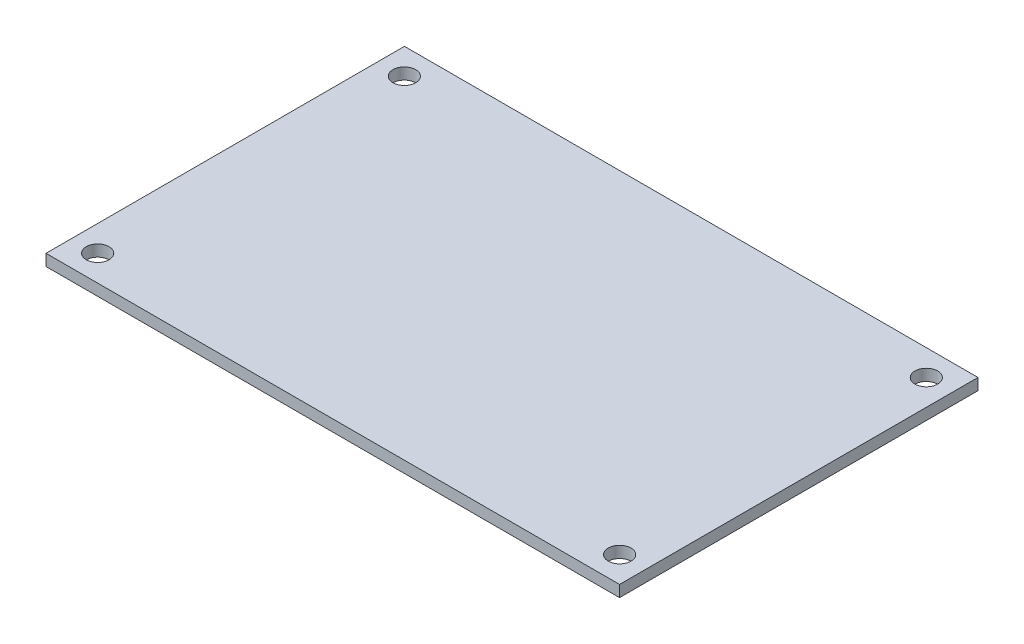
from build123d import *

# Parameters (mm, degrees)
SKETCH1_W           = 80
SKETCH1_H           = 50
BOSS_EXTRUDE1_DEPTH = 0.8001
SKETCH2_R           = 1.5875
CUT_EXTRUDE1_DEPTH  = 48.197040586


with BuildPart() as part:
    # Sketch1 → Boss-Extrude1 (new, symmetric)
    with BuildSketch(Plane(origin=(0, 0, 0), x_dir=(1, 0, 0), z_dir=(0, 1, 0))):
        Rectangle(SKETCH1_W, SKETCH1_H)
    extrude(amount=BOSS_EXTRUDE1_DEPTH, both=True)

    # Sketch2 → Cut-Extrude1 (cut, through all)
    with BuildSketch(Plane(origin=(0, 0.8001, 0), x_dir=(1, 0, 0), z_dir=(0, 1, 0))):
        with Locations(Location((-36.40283621, 21.38740377, 0), (0, 0, 270))):
            Circle(SKETCH2_R)
        with Locations(Location((-36.40283621, -21.38740377, 0), (0, 0, 270))):
            Circle(SKETCH2_R)
        with Locations(Location((36.40283621, -21.38740377, 0), (0, 0, 270))):
            Circle(SKETCH2_R)
        with Locations(Location((36.40283621, 21.38740377, 0), (0, 0, 270))):
            Circle(SKETCH2_R)
    extrude(amount=-CUT_EXTRUDE1_DEPTH, mode=Mode.SUBTRACT)


solid = part.part
